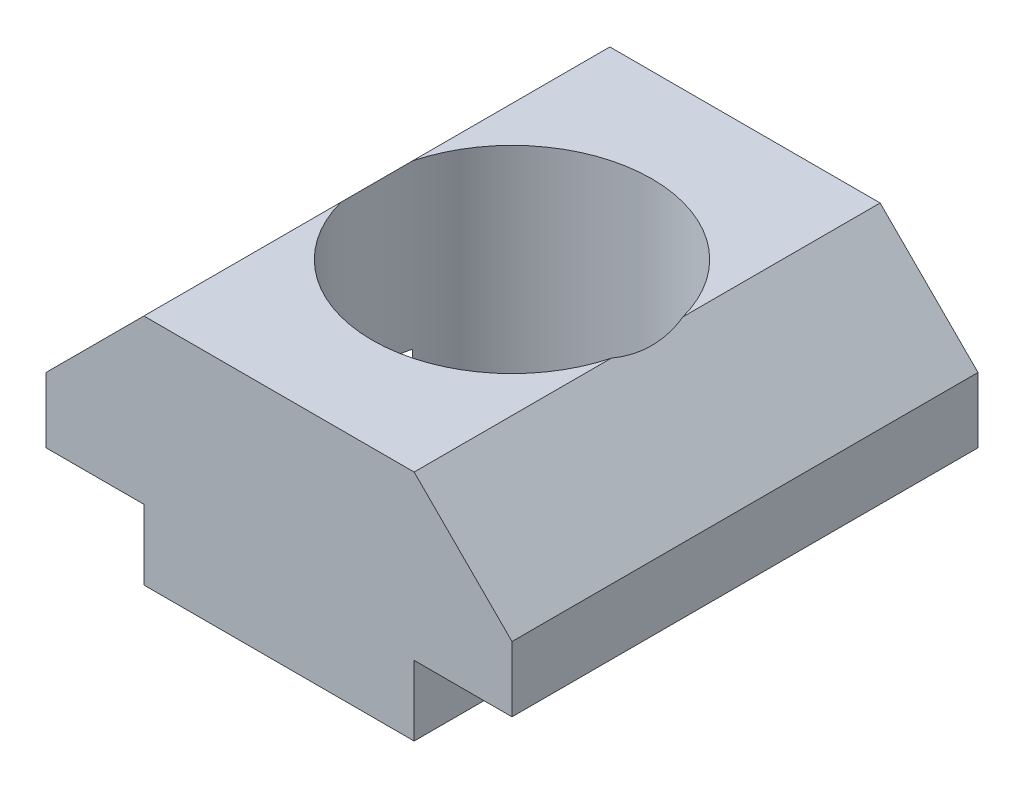
from build123d import *

# Parameters (mm, degrees)
EXTRUDE_1_DEPTH     = 10
SKETCH_4_R          = 3
CUT_EXTRUDE_1_DEPTH = 13.247448714


with BuildPart() as part:
    # 草图1 → 凸台-拉伸1 (new body)
    with BuildSketch(Plane.XY):
        Polygon((-2.9, 0), (2.9, 0), (2.9, 1.5), (5, 1.5), (5, 2.9), (2.9, 5), (-2.9, 5), (-5, 2.9), (-5, 1.5), (-2.9, 1.5), align=None)
    extrude(amount=-EXTRUDE_1_DEPTH)

    # 草图4 → 切除-拉伸1 (cut, through all)
    with BuildSketch(Plane(origin=(0, 5, 0), x_dir=(1, 0, 0), z_dir=(0, 1, 0))):
        with Locations(Location((0, 5, 0), (0, 0, 345.164888418))):
            Circle(SKETCH_4_R)
    extrude(amount=-CUT_EXTRUDE_1_DEPTH, mode=Mode.SUBTRACT)


solid = part.part
